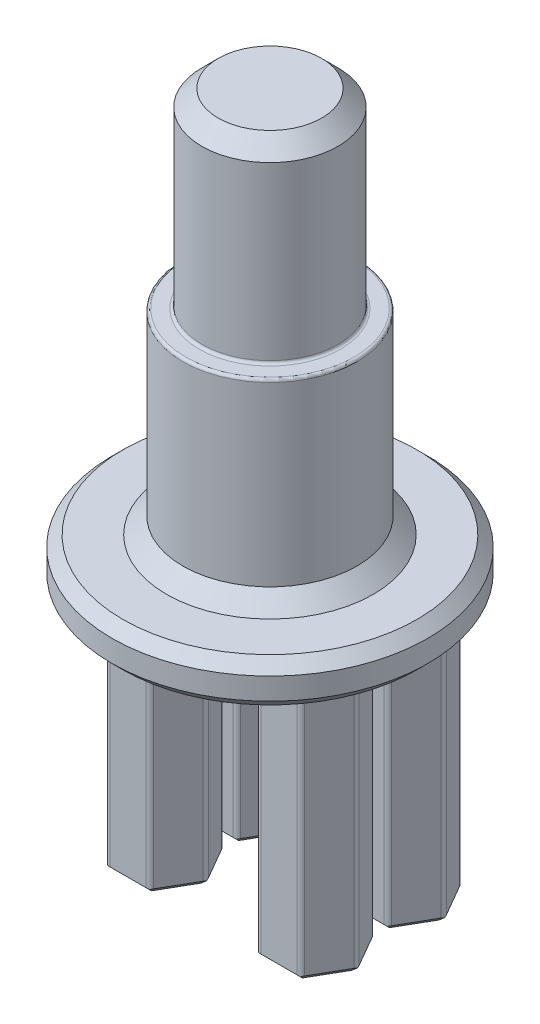
from build123d import *

# Parameters (mm, degrees)
SKETCH1_W                 = 91.997104186
SKETCH1_H                 = 68.052652412
BOSS_EXTRUDE1_DEPTH       = 8
SKETCH2_R                 = 16
BOSS_EXTRUDE2_DEPTH       = 36
SKETCH3_R                 = 12.5
BOSS_EXTRUDE3_DEPTH       = 35
FILLET1_R                 = 0.5
FILLET2_R                 = 0.5
CHAMFER1_SIZE             = 3
CHAMFER2_SIZE             = 3
BOSS_EXTRUDE4_DEPTH       = 48
CHAMFER3_SIZE             = 1
CHAMFER4_SIZE             = 1
FILLET4_R                 = 1
SKETCH7_OUTSIDE_W         = 128.188
SKETCH7_OUTSIDE_H         = 104.242
SKETCH7_OUTSIDE_R         = 29
CUT_EXTRUDE1_DEPTH        = 40
CHAMFER5_SIZE             = 2
F_4_0MM_DOWEL_HOLE1_D     = 4
F_4_0MM_DOWEL_HOLE1_DEPTH = 48
F_4_0MM_DOWEL_HOLE1_TIP   = 1.201721238


with BuildPart() as part:
    # Sketch1 → Boss-Extrude1 (new body)
    with BuildSketch(Plane(origin=(0, 0, 0), x_dir=(1, 0, 0), z_dir=(0, 1, 0))):
        Rectangle(SKETCH1_W, SKETCH1_H)
    extrude(amount=BOSS_EXTRUDE1_DEPTH)

    # Sketch2 → Boss-Extrude2 (add)
    with BuildSketch(Plane(origin=(0, 8, 0), x_dir=(1, 0, 0), z_dir=(0, 1, 0))):
        with Locations(Location((0, 0, 0), (0, 0, 270))):
            Circle(SKETCH2_R)
    extrude(amount=BOSS_EXTRUDE2_DEPTH)

    # Sketch3 → Boss-Extrude3 (add)
    with BuildSketch(Plane(origin=(0, 44, 0), x_dir=(1, 0, 0), z_dir=(0, 1, 0))):
        with Locations(Location((0, 0, 0), (0, 0, 270))):
            Circle(SKETCH3_R)
    extrude(amount=BOSS_EXTRUDE3_DEPTH)

    # Fillet1
    fillet1_edges = [part.edges().sort_by_distance(p)[0] for p in [
        (0, 44, -12.5),
    ]]
    fillet(fillet1_edges, radius=FILLET1_R)

    # Fillet2
    fillet2_edges = [part.edges().sort_by_distance(p)[0] for p in [
        (0, 44, -16),
    ]]
    fillet(fillet2_edges, radius=FILLET2_R)

    # Chamfer1
    chamfer1_edges = [part.edges().sort_by_distance(p)[0] for p in [
        (0, 79, -12.5),
    ]]
    chamfer(chamfer1_edges, length=CHAMFER1_SIZE)

    # Chamfer2
    chamfer2_edges = [part.edges().sort_by_distance(p)[0] for p in [
        (0, 8, -16),
    ]]
    chamfer(chamfer2_edges, length=CHAMFER2_SIZE)

    # Sketch4 → Boss-Extrude4 (add)
    with BuildSketch(Plane.XZ):
        Polygon((6.384573519, -10.21), (10.281687836, -16.96), (18.075916471, -16.96), (21.973030788, -10.21), (18.075916471, -3.46), (10.281687836, -3.46), align=None)
        Polygon((6.384573519, 5.79), (10.281687836, -0.96), (18.075916471, -0.96), (21.973030788, 5.79), (18.075916471, 12.54), (10.281687836, 12.54), align=None)
        Polygon((-21.335426481, 5.79), (-17.438312164, -0.96), (-9.644083529, -0.96), (-5.746969212, 5.79), (-9.644083529, 12.54), (-17.438312164, 12.54), align=None)
        Polygon((-21.335426481, -10.21), (-17.438312164, -16.96), (-9.644083529, -16.96), (-5.746969212, -10.21), (-9.644083529, -3.46), (-17.438312164, -3.46), align=None)
    extrude(amount=BOSS_EXTRUDE4_DEPTH)

    # Chamfer3
    chamfer3_edges = [part.edges().sort_by_distance(p)[0] for p in [
        (8.333130678, 0, -13.585),
        (14.178802154, 0, -16.96),
        (20.024473629, 0, -13.585),
        (20.024473629, 0, -6.835),
        (14.178802154, 0, -3.46),
        (8.333130678, 0, -6.835),
        (0, 0, 34.026326206),
        (-45.998552093, 0, 0),
        (8.333130678, 0, 2.415),
        (0, 0, -34.026326206),
        (14.178802154, 0, -0.96),
        (20.024473629, 0, 2.415),
        (20.024473629, 0, 9.165),
        (14.178802154, 0, 12.54),
        (8.333130678, 0, 9.165),
        (45.998552093, 0, 0),
        (-19.386869322, 0, 2.415),
        (-13.541197846, 0, -0.96),
        (-7.695526371, 0, 2.415),
        (-7.695526371, 0, 9.165),
        (-13.541197846, 0, 12.54),
        (-19.386869322, 0, 9.165),
        (-19.386869322, 0, -13.585),
        (-13.541197846, 0, -16.96),
        (-7.695526371, 0, -13.585),
        (-7.695526371, 0, -6.835),
        (-13.541197846, 0, -3.46),
        (-19.386869322, 0, -6.835),
    ]]
    chamfer(chamfer3_edges, length=CHAMFER3_SIZE)

    # Chamfer4
    chamfer4_edges = [part.edges().sort_by_distance(p)[0] for p in [
        (8.333130678, -48, -13.585),
        (14.178802154, -48, -16.96),
        (20.024473629, -48, -13.585),
        (20.024473629, -48, -6.835),
        (14.178802154, -48, -3.46),
        (8.333130678, -48, -6.835),
        (8.333130678, -48, 2.415),
        (14.178802154, -48, -0.96),
        (20.024473629, -48, 2.415),
        (20.024473629, -48, 9.165),
        (14.178802154, -48, 12.54),
        (8.333130678, -48, 9.165),
        (-19.386869322, -48, 2.415),
        (-13.541197846, -48, -0.96),
        (-7.695526371, -48, 2.415),
        (-7.695526371, -48, 9.165),
        (-13.541197846, -48, 12.54),
        (-19.386869322, -48, 9.165),
        (-19.386869322, -48, -13.585),
        (-13.541197846, -48, -16.96),
        (-7.695526371, -48, -13.585),
        (-7.695526371, -48, -6.835),
        (-13.541197846, -48, -3.46),
        (-19.386869322, -48, -6.835),
    ]]
    chamfer(chamfer4_edges, length=CHAMFER4_SIZE)

    # Fillet4
    fillet4_edges = [part.edges().sort_by_distance(p)[0] for p in [
        (10.281687836, -24, 12.54),
        (6.384573519, -24, 5.79),
        (18.075916471, -24, 12.54),
        (21.973030788, -24, 5.79),
        (18.075916471, -24, -0.96),
        (10.281687836, -24, -0.96),
        (-17.438312164, -24, 12.54),
        (-21.335426481, -24, 5.79),
        (-9.644083529, -24, 12.54),
        (-5.746969212, -24, 5.79),
        (-9.644083529, -24, -0.96),
        (-17.438312164, -24, -0.96),
        (-17.438312164, -24, -3.46),
        (-21.335426481, -24, -10.21),
        (-9.644083529, -24, -3.46),
        (-5.746969212, -24, -10.21),
        (-9.644083529, -24, -16.96),
        (-17.438312164, -24, -16.96),
        (10.281687836, -24, -3.46),
        (6.384573519, -24, -10.21),
        (18.075916471, -24, -3.46),
        (21.973030788, -24, -10.21),
        (18.075916471, -24, -16.96),
        (10.281687836, -24, -16.96),
    ]]
    fillet(fillet4_edges, radius=FILLET4_R)

    # Sketch7 outside → Cut-Extrude1 (cut)
    with BuildSketch(Plane.XZ):
        Rectangle(SKETCH7_OUTSIDE_W, SKETCH7_OUTSIDE_H)
        with Locations(Location((0, 0, 0), (0, 0, 270))):
            Circle(SKETCH7_OUTSIDE_R, mode=Mode.SUBTRACT)
    extrude(amount=-CUT_EXTRUDE1_DEPTH, mode=Mode.SUBTRACT)

    # Chamfer5
    chamfer5_edges = [part.edges().sort_by_distance(p)[0] for p in [
        (0, 8, 29),
        (0, 0, 29),
    ]]
    chamfer(chamfer5_edges, length=CHAMFER5_SIZE)

    # Ø4.0mm Dowel Hole1
    with Locations(Plane.XZ.offset(48)):
        with Locations((14.178802154, 5.79), (-13.541197846, 5.79), (-13.541197846, -10.21), (14.178802154, -10.21)):
            Hole(F_4_0MM_DOWEL_HOLE1_D / 2, depth=F_4_0MM_DOWEL_HOLE1_DEPTH)
            with Locations((0, 0, -(F_4_0MM_DOWEL_HOLE1_DEPTH + F_4_0MM_DOWEL_HOLE1_TIP / 2))):  # 118° drill point
                Cone(0, F_4_0MM_DOWEL_HOLE1_D / 2, F_4_0MM_DOWEL_HOLE1_TIP, mode=Mode.SUBTRACT)


solid = part.part
